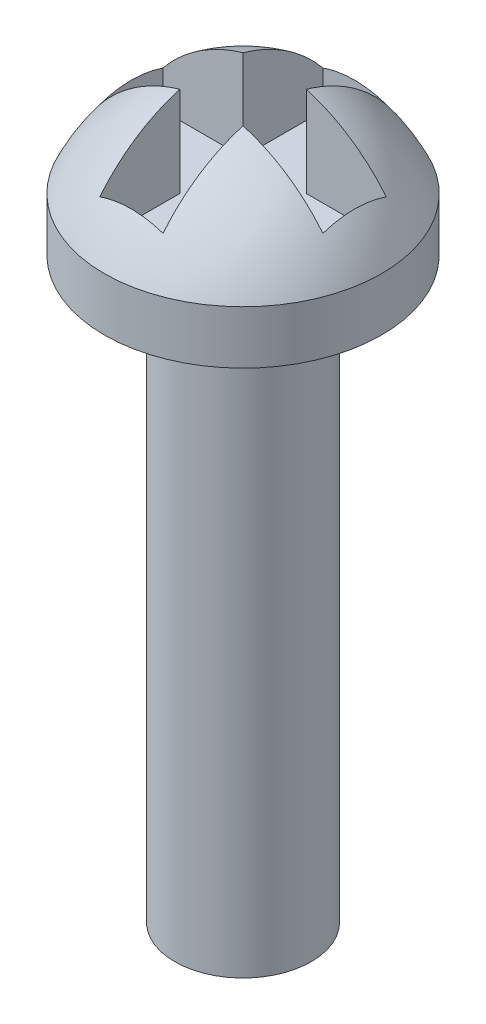
from build123d import *

# Parameters (mm, degrees)
CUT_EXTRUDE1_REACH = 16.523
SKETCH2_W          = 4.904374576
SKETCH2_H          = 1.390216618
SKETCH2_W_2        = 1.390216618
SKETCH2_H_2        = 4.904374576


with BuildPart() as part:
    # Sketch1 → Revolve1 (revolve)
    with BuildSketch(Plane.XY, mode=Mode.PRIVATE) as revolve1_sk:
        with BuildLine():
            Line((0, 0), (0, 12.7))
            Line((0, 12.7), (0, 13.8684))
            Line((0, 13.8684), (0, 16.128443135))
            add(Edge.make_bspline(
                [(0, 16.128443135), (2.158115005, 15.748885895), (3.048, 13.8684)],
                knots=[0, 0, 0, 1, 1, 1], degree=2))
            Line((3.048, 13.8684), (3.048, 12.7))
            Line((3.048, 12.7), (1.5, 12.7))
            Line((1.5, 12.7), (1.5, 0))
            Line((1.5, 0), (0, 0))
        make_face()
    revolve(revolve1_sk.sketch.rotate(Axis((0, 18.881175956, 0), (0, -1, 0)), 90), axis=Axis((0, 18.881175956, 0), (0, -1, 0)))

    # Sketch2 → Cut-Extrude1 (cut, up to next)
    with BuildSketch(Plane(origin=(0, 13.8684, 0), x_dir=(-1, 0, 0), z_dir=(0, -1, 0)), mode=Mode.PRIVATE) as cut_extrude1_sk1:
        Rectangle(SKETCH2_W, SKETCH2_H)
    cut_extrude1_tool1 = extrude(cut_extrude1_sk1.sketch, amount=-CUT_EXTRUDE1_REACH, mode=Mode.PRIVATE) & part.part
    # Sketch2 → Cut-Extrude1 (cut, up to next)
    with BuildSketch(Plane(origin=(0, 13.8684, 0), x_dir=(-1, 0, 0), z_dir=(0, -1, 0)), mode=Mode.PRIVATE) as cut_extrude1_sk2:
        Rectangle(SKETCH2_W_2, SKETCH2_H_2)
    cut_extrude1_tool2 = extrude(cut_extrude1_sk2.sketch, amount=-CUT_EXTRUDE1_REACH, mode=Mode.PRIVATE) & part.part
    add(cut_extrude1_tool1.solids().sort_by_distance((0, 13.8684, 0))[0], mode=Mode.SUBTRACT)
    add(cut_extrude1_tool2.solids().sort_by_distance((0, 13.8684, 0))[0], mode=Mode.SUBTRACT)


solid = part.part
